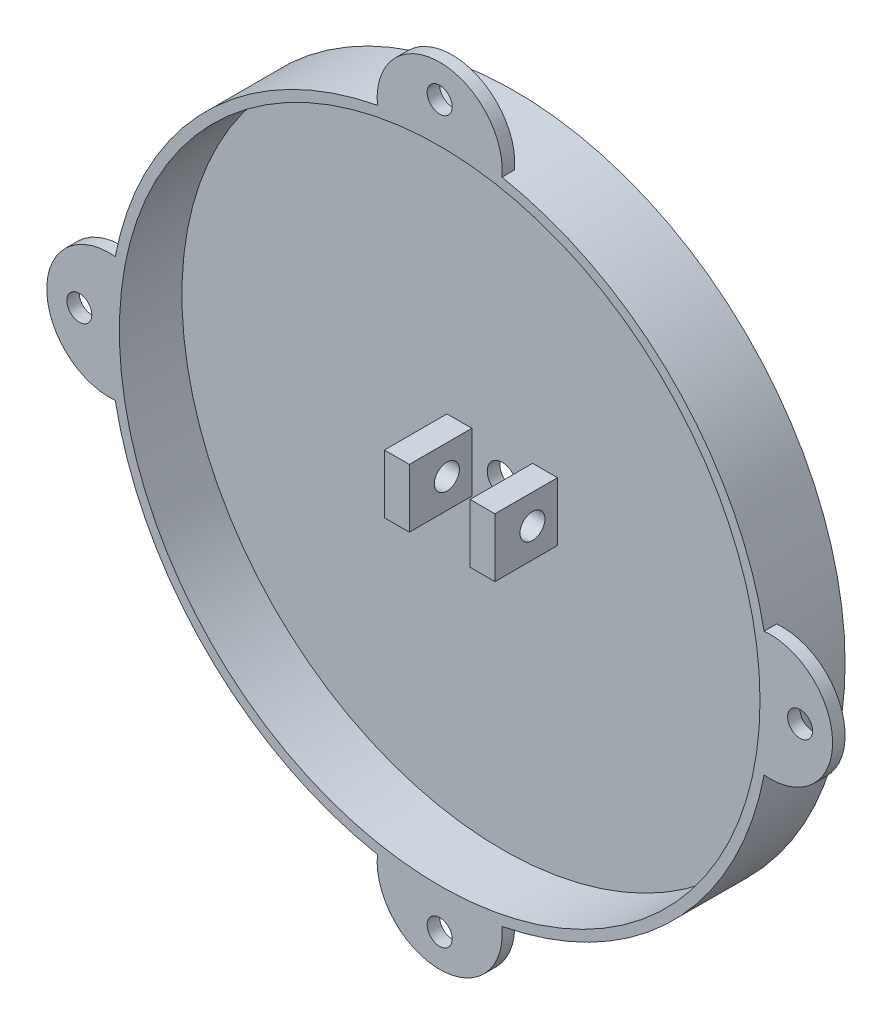
from build123d import *

# Parameters (mm, degrees)
SKETCH1_R           = 132
BOSS_EXTRUDE1_DEPTH = 5
SKETCH2_R           = 132
SKETCH2_R_2         = 128
BOSS_EXTRUDE2_DEPTH = 25
SKETCH3_R           = 25
BOSS_EXTRUDE3_DEPTH = 25
SKETCH4_W           = 24.259702766
SKETCH4_H           = 53.634785552
CUT_EXTRUDE1_DEPTH  = 25
SKETCH5_W           = 53.321862162
SKETCH5_H           = 77.08657154
SKETCH5_W_2         = 44.150486072
SKETCH5_H_2         = 70.031666854
CUT_EXTRUDE2_DEPTH  = 25
SKETCH6_W           = 57.100495662
SKETCH6_H           = 46.822548266
SKETCH6_W_2         = 44.150486072
SKETCH6_H_2         = 23.467734864
CUT_EXTRUDE4_DEPTH  = 25
SKETCH7_R           = 5
CUT_EXTRUDE5_DEPTH  = 60
SKETCH8_R           = 6
CUT_EXTRUDE6_DEPTH  = 30
BOSS_EXTRUDE4_START = -5
SKETCH9_R           = 5
BOSS_EXTRUDE4_DEPTH = 5
CIRPATTERN1_COUNT   = 4


with BuildPart() as part:
    # Sketch1 → Boss-Extrude1 (new body)
    with BuildSketch(Plane.XY):
        Circle(SKETCH1_R)
    extrude(amount=BOSS_EXTRUDE1_DEPTH)

    # Sketch2 → Boss-Extrude2 (add)
    with BuildSketch(Plane.XY.offset(5)):
        Circle(SKETCH2_R)
        Circle(SKETCH2_R_2, mode=Mode.SUBTRACT)
    extrude(amount=BOSS_EXTRUDE2_DEPTH)

    # Sketch3 → Boss-Extrude3 (add)
    with BuildSketch(Plane.XY.offset(5)):
        Circle(SKETCH3_R)
    extrude(amount=BOSS_EXTRUDE3_DEPTH)

    # Sketch4 → Cut-Extrude1 (cut)
    with BuildSketch(Plane.XY.offset(30)):
        Rectangle(SKETCH4_W, SKETCH4_H)
    extrude(amount=-CUT_EXTRUDE1_DEPTH, mode=Mode.SUBTRACT)

    # Sketch5 → Cut-Extrude2 (cut)
    with BuildSketch(Plane.XY.offset(30)):
        Rectangle(SKETCH5_W, SKETCH5_H)
        Rectangle(SKETCH5_W_2, SKETCH5_H_2, mode=Mode.SUBTRACT)
    extrude(amount=-CUT_EXTRUDE2_DEPTH, mode=Mode.SUBTRACT)

    # Sketch6 → Cut-Extrude4 (cut)
    with BuildSketch(Plane.XY.offset(30)):
        Rectangle(SKETCH6_W, SKETCH6_H)
        Rectangle(SKETCH6_W_2, SKETCH6_H_2, mode=Mode.SUBTRACT)
    extrude(amount=-CUT_EXTRUDE4_DEPTH, mode=Mode.SUBTRACT)

    # Sketch7 → Cut-Extrude5 (cut)
    with BuildSketch(Plane(origin=(22.075243036, 0, 0), x_dir=(0, 0, -1), z_dir=(1, 0, 0))):
        with Locations((-15, 0)):
            Circle(SKETCH7_R)
    extrude(amount=-CUT_EXTRUDE5_DEPTH, mode=Mode.SUBTRACT)

    # Sketch8 → Cut-Extrude6 (cut, symmetric)
    with BuildSketch(Plane.XY.offset(5)):
        Circle(SKETCH8_R)
    extrude(amount=CUT_EXTRUDE6_DEPTH, both=True, mode=Mode.SUBTRACT)

    # Sketch9 → Boss-Extrude4 (add)
    with BuildSketch(Plane.XY.offset(30).offset(BOSS_EXTRUDE4_START)):
        with BuildLine():
            ThreePointArc((-129.632575758, -24.887653615), (-132, 0), (-129.632575758, 24.887653615))
            ThreePointArc((-129.632575758, 24.887653615), (-157, 0), (-129.632575758, -24.887653615))
        make_face()
        with Locations((-144.000711393, 0)):
            Circle(SKETCH9_R, mode=Mode.SUBTRACT)
    boss_extrude4 = extrude(amount=BOSS_EXTRUDE4_DEPTH)

    # CirPattern1: Boss-Extrude4 ×4 about axis
    cirpattern1_axis = Axis((0, 0, 0), (0, 0, 1))
    for i in range(1, CIRPATTERN1_COUNT):
        add(boss_extrude4.rotate(cirpattern1_axis, i * 360 / CIRPATTERN1_COUNT))


solid = part.part
